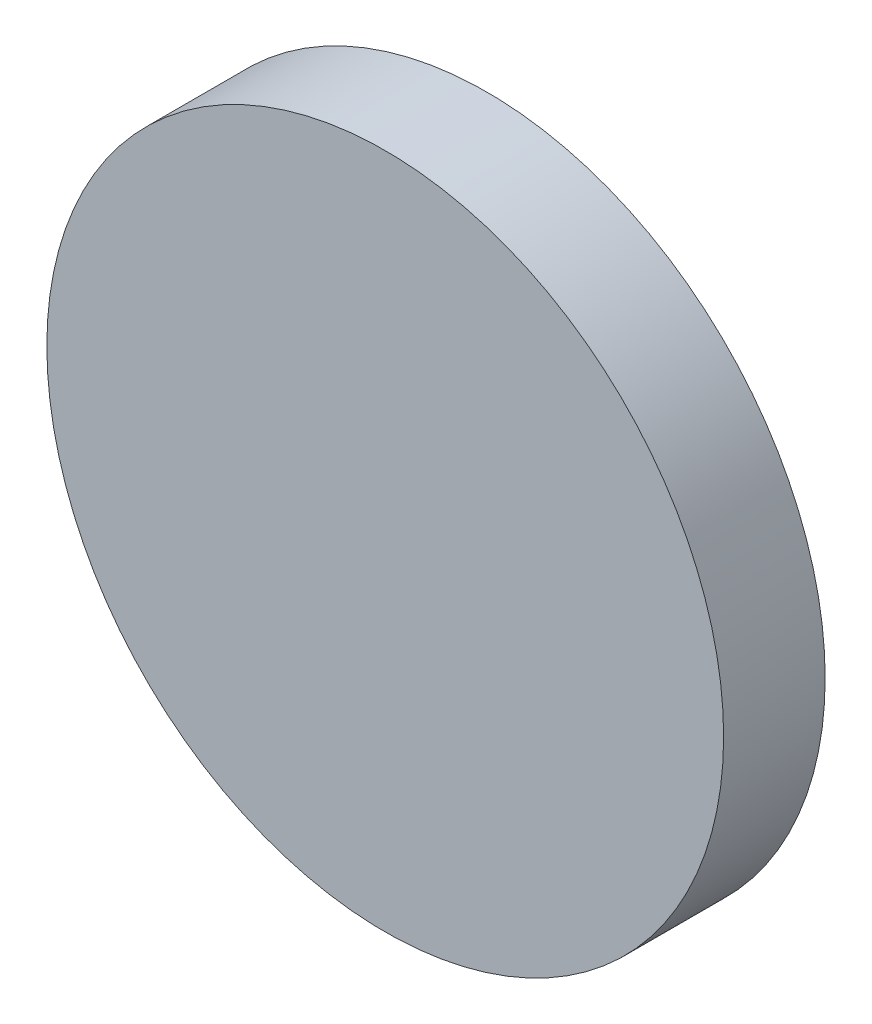
from build123d import *

# Parameters (mm, degrees)
ESQUISSE1_R        = 10
BOSS_EXTRU_1_DEPTH = 3


with BuildPart() as part:
    # Esquisse1 → Boss.-Extru.1 (new body)
    with BuildSketch(Plane.XY):
        Circle(ESQUISSE1_R)
    extrude(amount=BOSS_EXTRU_1_DEPTH)


solid = part.part
